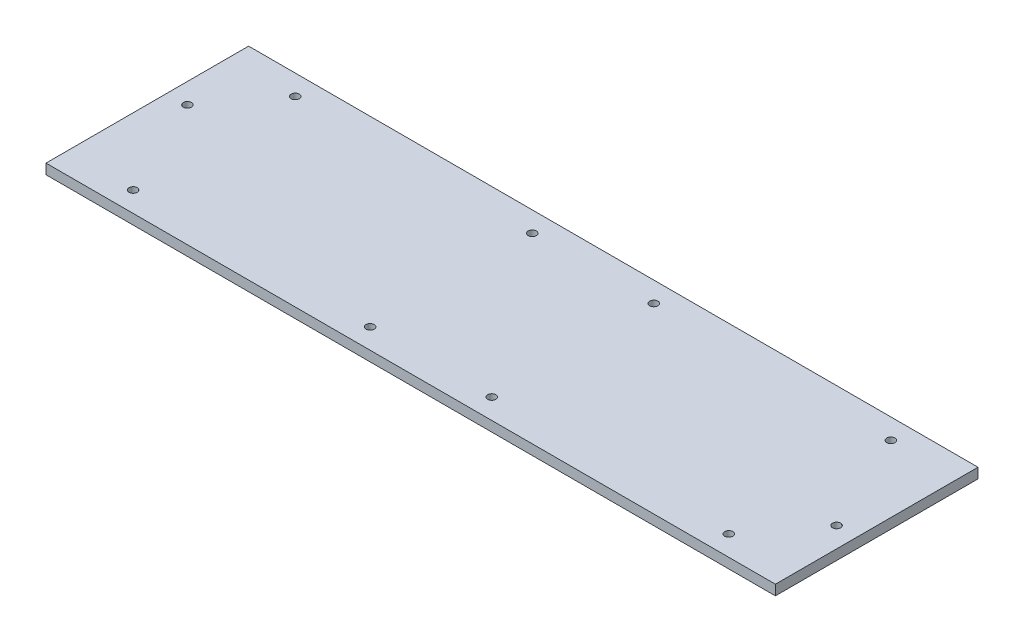
from build123d import *

# Parameters (mm, degrees)
SKETCH1_W           = 457.2
SKETCH1_H           = 127
SKETCH1_R           = 2.5527
BOSS_EXTRUDE1_DEPTH = 6.35


with BuildPart() as part:
    # Sketch1 → Boss-Extrude1 (new body)
    with BuildSketch(Plane(origin=(0, 0, 0), x_dir=(1, 0, 0), z_dir=(0, 1, 0))):
        with Locations((228.6, 63.5)):
            Rectangle(SKETCH1_W, SKETCH1_H)
        with Locations(Location((41.91, 114.3, 0), (0, 0, 270))):
            Circle(SKETCH1_R, mode=Mode.SUBTRACT)
        with Locations(Location((415.29, 114.3, 0), (0, 0, 270))):
            Circle(SKETCH1_R, mode=Mode.SUBTRACT)
        with Locations(Location((415.29, 12.7, 0), (0, 0, 270))):
            Circle(SKETCH1_R, mode=Mode.SUBTRACT)
        with Locations(Location((41.91, 12.7, 0), (0, 0, 270))):
            Circle(SKETCH1_R, mode=Mode.SUBTRACT)
        with Locations(Location((190.5, 114.3, 0), (0, 0, 270))):
            Circle(SKETCH1_R, mode=Mode.SUBTRACT)
        with Locations(Location((266.7, 114.3, 0), (0, 0, 270))):
            Circle(SKETCH1_R, mode=Mode.SUBTRACT)
        with Locations(Location((190.5, 12.7, 0), (0, 0, 270))):
            Circle(SKETCH1_R, mode=Mode.SUBTRACT)
        with Locations(Location((266.7, 12.7, 0), (0, 0, 270))):
            Circle(SKETCH1_R, mode=Mode.SUBTRACT)
        with Locations(Location((444.5, 51.054, 0), (0, 0, 270))):
            Circle(SKETCH1_R, mode=Mode.SUBTRACT)
        with Locations(Location((12.7, 75.946, 0), (0, 0, 270))):
            Circle(SKETCH1_R, mode=Mode.SUBTRACT)
    extrude(amount=BOSS_EXTRUDE1_DEPTH)


solid = part.part
